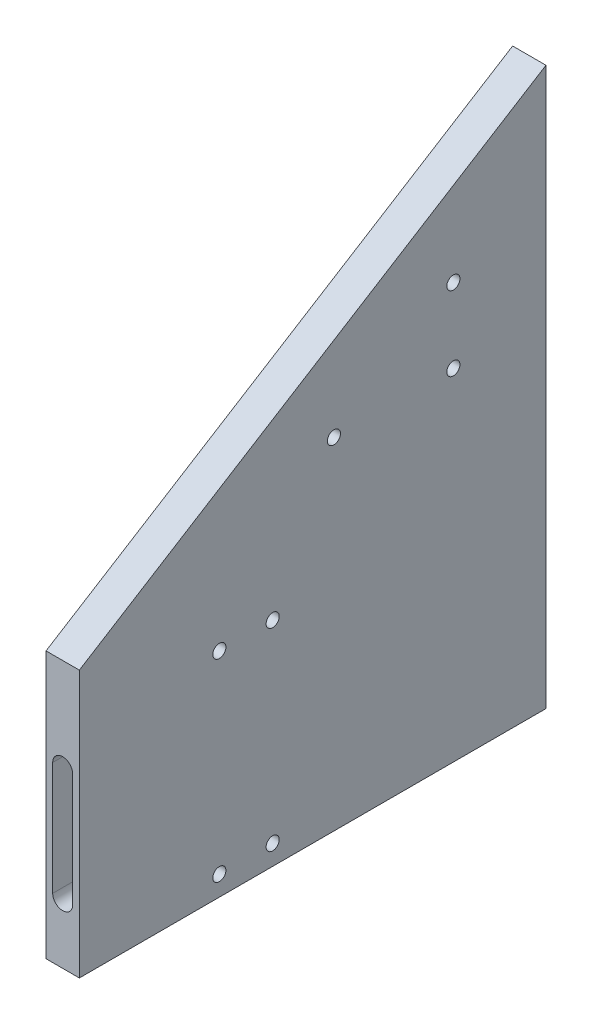
from build123d import *

# Parameters (mm, degrees)
BOSS_EXTRUDE1_DEPTH   = 177.8
BOSS_EXTRUDE2_DEPTH   = 12.7
BOSS_EXTRUDE4_DEPTH   = 4.445
BOSS_EXTRUDE5_DEPTH   = 4.445
M6X1_0_TAPPED_HOLE1_D = 5
M6X1_0_TAPPED_HOLE2_D = 5


with BuildPart() as part:
    # Sketch1 → Boss-Extrude1 (new body)
    with BuildSketch(Plane.XY):
        with BuildLine():
            Line((0, 88.9), (0, 44.45))
            Line((0, 44.45), (2.54, 44.45))
            Line((2.54, 44.45), (2.54, 66.04))
            ThreePointArc((2.54, 66.04), (3.655923164, 68.734076836), (6.35, 69.85))
            ThreePointArc((6.35, 69.85), (9.044076836, 68.734076836), (10.16, 66.04))
            Line((10.16, 66.04), (10.16, 44.45))
            Line((10.16, 44.45), (12.7, 44.45))
            Line((12.7, 44.45), (12.7, 88.9))
            Line((12.7, 88.9), (0, 88.9))
        make_face()
        with BuildLine():
            Line((0, 44.45), (0, 0))
            Line((0, 0), (12.7, 0))
            Line((12.7, 0), (12.7, 44.45))
            Line((12.7, 44.45), (10.16, 44.45))
            Line((10.16, 44.45), (10.16, 22.86))
            ThreePointArc((10.16, 22.86), (9.044076836, 20.165923164), (6.35, 19.05))
            ThreePointArc((6.35, 19.05), (3.655923164, 20.165923164), (2.54, 22.86))
            Line((2.54, 22.86), (2.54, 44.45))
            Line((2.54, 44.45), (0, 44.45))
        make_face()
    extrude(amount=BOSS_EXTRUDE1_DEPTH)

    # Sketch5 → Boss-Extrude2 (add)
    with BuildSketch(Plane(origin=(0, 0, 0), x_dir=(0, 0, -1), z_dir=(1, 0, 0))):
        Polygon((-177.8, 101.6), (-177.8, 88.9), (0, 88.9), (0, 101.6), (-12.013513514, 101.6), (-165.786486486, 101.6), align=None)
        Polygon((-49.675142857, 181.378572199), (-177.8, 101.6), (-165.786486486, 101.6), (-88.904700233, 149.471422238), (-46.318714286, 175.988128132), align=None)
        Polygon((0, 212.309431825), (-49.675142857, 181.378572199), (-46.318714286, 175.988128132), (0, 204.82906481), align=None)
    extrude(amount=BOSS_EXTRUDE2_DEPTH)

    # Sketch6 → Boss-Extrude4 (add)
    with BuildSketch(Plane(origin=(12.7, 0, 0), x_dir=(0, 0, -1), z_dir=(1, 0, 0))):
        Polygon((-88.904700233, 149.471422238), (-165.786486486, 101.6), (-12.013513514, 101.6), (-3.356428571, 106.990444068), (-46.318714286, 175.988128132), align=None)
        Polygon((0, 204.82906481), (-46.318714286, 175.988128132), (-3.356428571, 106.990444068), (0, 109.080367015), align=None)
        Polygon((-12.013513514, 101.6), (0, 101.6), (-3.356428571, 106.990444068), align=None)
        Polygon((-3.356428571, 106.990444068), (0, 101.6), (0, 109.080367015), align=None)
    extrude(amount=-BOSS_EXTRUDE4_DEPTH)

    # Sketch5<6> → Boss-Extrude5 (add)
    with BuildSketch(Plane(origin=(0, 0, 0), x_dir=(0, 0, -1), z_dir=(1, 0, 0))):
        Polygon((-88.904700233, 149.471422238), (-165.786486486, 101.6), (-12.013513514, 101.6), (-3.356428571, 106.990444068), (-46.318714286, 175.988128132), align=None)
        Polygon((0, 204.82906481), (-46.318714286, 175.988128132), (-3.356428571, 106.990444068), (0, 109.080367015), align=None)
        Polygon((-12.013513514, 101.6), (0, 101.6), (-3.356428571, 106.990444068), align=None)
        Polygon((-3.356428571, 106.990444068), (0, 101.6), (0, 109.080367015), align=None)
    extrude(amount=BOSS_EXTRUDE5_DEPTH)

    # M6x1.0 Tapped Hole1 (through all)
    with Locations(Plane(origin=(12.7, 0, 0), x_dir=(0, 0, -1), z_dir=(1, 0, 0))):
        with Locations((-124.46, 7.62), (-104.14, 81.28), (-124.46, 81.28), (-104.14, 7.62)):
            Hole(M6X1_0_TAPPED_HOLE1_D / 2)

    # M6x1.0 Tapped Hole2 (through all)
    with Locations(Plane(origin=(0, 0, 0), x_dir=(0, 0, -1), z_dir=(-1, 0, 0))):
        with Locations((-35.287182484, -129.93571152), (-80.794502188, -129.93571152), (-35.287182484, -158.271423041)):
            Hole(M6X1_0_TAPPED_HOLE2_D / 2)


solid = part.part
